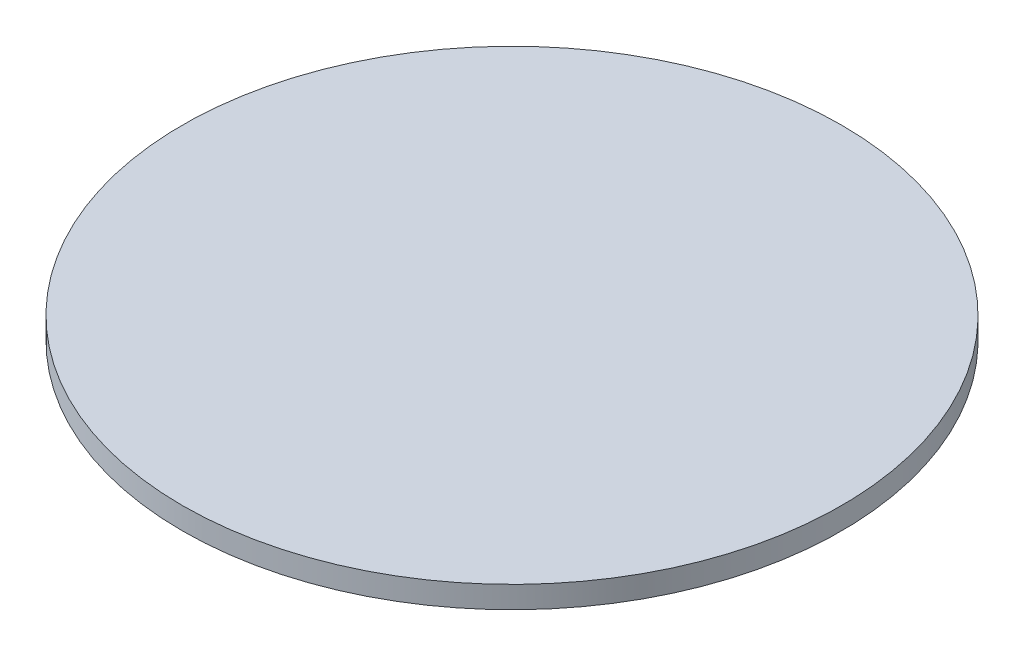
from build123d import *

# Parameters (mm, degrees)
SKIZZE1_R                         = 10
AUFSATZ_LINEAR_AUSTRAGEN1_DEPTH   = 1
SKIZZE2_R                         = 30
AUFSATZ_LINEAR_AUSTRAGEN2_DEPTH   = 2
AUFSATZ_LINEAR_AUSTRAGEN3_DEPTH   = 1
AUFSATZ_LINEAR_AUSTRAGEN3_2_DEPTH = 1
SKIZZE4_R                         = 10
AUFSATZ_LINEAR_AUSTRAGEN4_DEPTH   = 1
AUFSATZ_LINEAR_START              = 3
AUFSATZ_LINEAR_AUSTRAGEN15_DEPTH  = 3


with BuildPart() as part:
    # Skizze1 → Aufsatz-Linear austragen1 (new body)
    with BuildSketch(Plane(origin=(0, 0, 0), x_dir=(1, 0, 0), z_dir=(0, 1, 0))):
        with Locations(Location((0, 0, 0), (0, 0, 270))):
            Circle(SKIZZE1_R)
    extrude(amount=-AUFSATZ_LINEAR_AUSTRAGEN1_DEPTH)

    # Skizze2 → Aufsatz-Linear austragen2 (add)
    with BuildSketch(Plane(origin=(0, 0, 0), x_dir=(1, 0, 0), z_dir=(0, 1, 0))):
        with Locations(Location((0, 0, 0), (0, 0, 270))):
            Circle(SKIZZE2_R)
    extrude(amount=AUFSATZ_LINEAR_AUSTRAGEN2_DEPTH)



with BuildPart() as body_2:
    # Skizze3 → Aufsatz-Linear austragen3 (new body)
    with BuildSketch(Plane.XZ.offset(1)):
        with BuildLine():
            Line((-7.071067812, 7.071067812), (-9.192388155, 9.192388155))
            ThreePointArc((-9.192388155, 9.192388155), (-13, 0), (-9.192388155, -9.192388155))
            Line((-9.192388155, -9.192388155), (-7.071067812, -7.071067812))
            ThreePointArc((-7.071067812, -7.071067812), (-10, 0), (-7.071067812, 7.071067812))
        make_face()
    extrude(amount=AUFSATZ_LINEAR_AUSTRAGEN3_DEPTH)


with BuildPart() as body_3:
    # Skizze3 → Aufsatz-Linear austragen3 2 (new body)
    with BuildSketch(Plane.XZ.offset(1)):
        with BuildLine():
            Line((7.071067812, 7.071067812), (9.192388155, 9.192388155))
            ThreePointArc((9.192388155, 9.192388155), (13, 0), (9.192388155, -9.192388155))
            Line((9.192388155, -9.192388155), (7.071067812, -7.071067812))
            ThreePointArc((7.071067812, -7.071067812), (10, 0), (7.071067812, 7.071067812))
        make_face()
    extrude(amount=AUFSATZ_LINEAR_AUSTRAGEN3_2_DEPTH)


with BuildPart() as part_1:
    add(part.part)

    add(body_2.part)  # Aufsatz-Linear austragen4 merges body 2

    add(body_3.part)  # Aufsatz-Linear austragen4 merges body 3
    # Skizze4 → Aufsatz-Linear austragen4 (add)
    with BuildSketch(Plane.XZ.offset(1)):
        with Locations(Location((0, 0, 0), (0, 0, 90))):
            Circle(SKIZZE4_R)
    extrude(amount=AUFSATZ_LINEAR_AUSTRAGEN4_DEPTH)

    # Skizze8 → Aufsatz-Linear austragen15 (add)
    with BuildSketch(Plane(origin=(0, -1, 0), x_dir=(1, 0, 0), z_dir=(0, 1, 0)).offset(AUFSATZ_LINEAR_START)):
        with BuildLine():
            Line((10.076521944, -8.213629254), (7.737557516, -6.334840462))
            ThreePointArc((7.737557516, -6.334840462), (7.413457608, -6.711232845), (7.071067812, -7.071067812))
            Line((7.071067812, -7.071067812), (9.192388155, -9.192388155))
            ThreePointArc((9.192388155, -9.192388155), (9.646875989, -8.714228804), (10.076521944, -8.213629254))
        make_face()
        with BuildLine():
            Line((-7.071067812, 7.071067812), (-9.192388155, 9.192388155))
            ThreePointArc((-9.192388155, 9.192388155), (-9.636776415, 8.725396284), (-10.057468336, 8.236949111))
            Line((-10.057468336, 8.236949111), (-7.732766819, 6.340687449))
            ThreePointArc((-7.732766819, 6.340687449), (-7.410920578, 6.714034271), (-7.071067812, 7.071067812))
        make_face()
    extrude(amount=-AUFSATZ_LINEAR_AUSTRAGEN15_DEPTH)


solid = part_1.part
